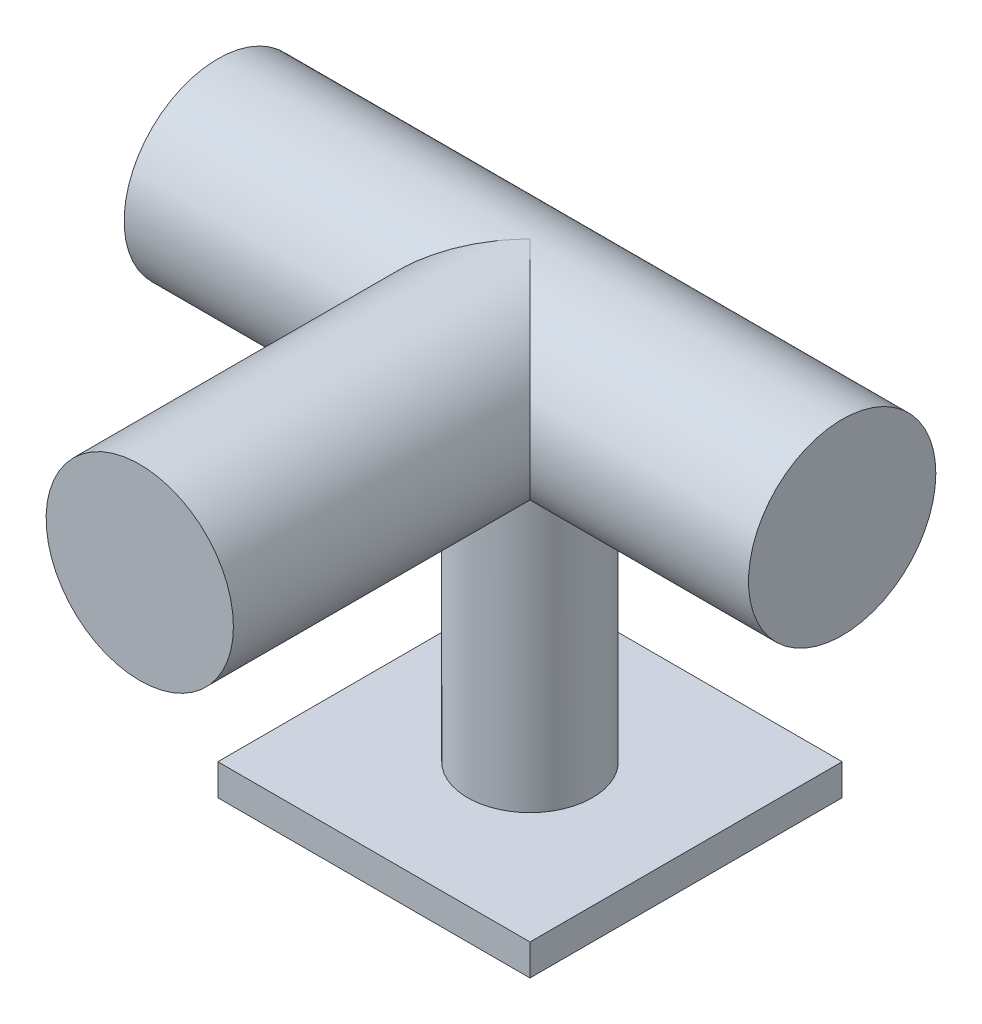
from build123d import *

# Parameters (mm, degrees)
RUN_START          = -20
SKETCH1_R          = 6
RUN_DEPTH          = 40
SKETCH2_R          = 6
BRANCH_DEPTH       = 25
SKETCH3_R          = 4
SUPPORT_POST_DEPTH = 20
SKETCH4_W          = 20
SKETCH4_H          = 20
SUPPORT_FOOT_DEPTH = 2


with BuildPart() as part:
    # Sketch1 → Run (new body)
    with BuildSketch(Plane(origin=(0, 0, 0), x_dir=(0, 0, -1), z_dir=(1, 0, 0)).offset(RUN_START)):
        with Locations((0, 25)):
            Circle(SKETCH1_R)
    extrude(amount=RUN_DEPTH)

    # Sketch2 → Branch (add)
    with BuildSketch(Plane.XY):
        with Locations(Location((0, 25, 0), (0, 0, 90))):
            Circle(SKETCH2_R)
    extrude(amount=BRANCH_DEPTH)

    # Sketch3 → Support_Post (add)
    with BuildSketch(Plane(origin=(0, 0, 0), x_dir=(1, 0, 0), z_dir=(0, 1, 0))):
        with Locations(Location((0, 0, 0), (0, 0, 123.987843581))):
            Circle(SKETCH3_R)
    extrude(amount=SUPPORT_POST_DEPTH)

    # Sketch4 → Support_Foot (add)
    with BuildSketch(Plane(origin=(0, 0, 0), x_dir=(1, 0, 0), z_dir=(0, 1, 0))):
        Rectangle(SKETCH4_W, SKETCH4_H)
    extrude(amount=SUPPORT_FOOT_DEPTH)


solid = part.part
